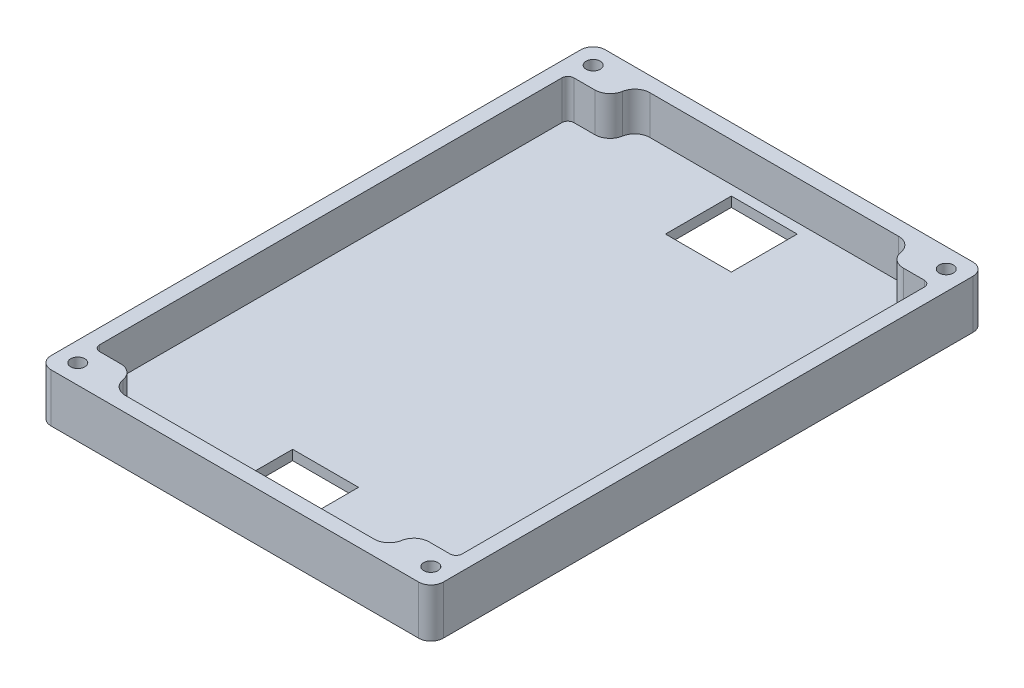
from build123d import *

# Parameters (mm, degrees)
BOSS_EXTRUDE1_DEPTH                                 = 15.0114
CUT_EXTRUDE1_DEPTH                                  = 11.9634
MIRROR2_COPY_1_DEPTH                                = 11.9634
CBORE_SLOT_FOR_3_BINDING_HEAD_MACHINE_S_D           = 4.3688
CBORE_SLOT_FOR_3_BINDING_HEAD_MACHINE_S_CBORE_D     = 7.874
CBORE_SLOT_FOR_3_BINDING_HEAD_MACHINE_S_CBORE_DEPTH = 3.048
MIRROR4_COPY_1_D                                    = 4.3688
MIRROR4_COPY_1_CBORE_D                              = 7.874
MIRROR4_COPY_1_CBORE_DEPTH                          = 3.048
SKETCH10_W                                          = 20.32
SKETCH10_H                                          = 20.32
CUT_EXTRUDE3_DEPTH                                  = 3.048


with BuildPart() as part:
    # Sketch2 → Boss-Extrude1 (new body)
    with BuildSketch(Plane(origin=(0, 0, 0), x_dir=(1, 0, 0), z_dir=(0, 1, 0))):
        with BuildLine():
            Line((56.6928, -85.4964), (-56.6928, -85.4964))
            ThreePointArc((-56.6928, -85.4964), (-59.386876836, -84.380476836), (-60.5028, -81.6864))
            Line((-60.5028, -81.6864), (-60.5028, 81.6864))
            ThreePointArc((-60.5028, 81.6864), (-59.386876836, 84.380476836), (-56.6928, 85.4964))
            Line((-56.6928, 85.4964), (56.6928, 85.4964))
            ThreePointArc((56.6928, 85.4964), (59.386876836, 84.380476836), (60.5028, 81.6864))
            Line((60.5028, 81.6864), (60.5028, -81.6864))
            ThreePointArc((60.5028, -81.6864), (59.386876836, -84.380476836), (56.6928, -85.4964))
        make_face()
    extrude(amount=BOSS_EXTRUDE1_DEPTH)

    # Sketch3 → Cut-Extrude1 (cut)
    with BuildSketch(Plane(origin=(0, 15.0114, 0), x_dir=(1, 0, 0), z_dir=(0, 1, 0))):
        with BuildLine():
            Line((-55.9054, 0), (-55.9054, 71.294481899))
            ThreePointArc((-55.9054, 71.294481899), (-55.361345544, 72.607945544), (-54.047881899, 73.152))
            Line((-54.047881899, 73.152), (-47.553880656, 73.152))
            ThreePointArc((-47.553880656, 73.152), (-44.550315934, 74.249721203), (-42.962410096, 77.0255))
            ThreePointArc((-42.962410096, 77.0255), (-41.374504259, 79.801278797), (-38.370939537, 80.899))
            Line((-38.370939537, 80.899), (0, 80.899))
            Line((0, 80.899), (0, 0))
            Line((0, 0), (-55.9054, 0))
        make_face()
    cut_extrude1 = extrude(amount=-CUT_EXTRUDE1_DEPTH, mode=Mode.SUBTRACT)

    # Mirror1: Cut-Extrude1 across plane
    add(cut_extrude1.mirror(Plane(origin=(0, 0, 0), x_dir=(0, 0, 1), z_dir=(1, 0, 0))), mode=Mode.SUBTRACT)

    # Mirror2: Cut-Extrude1 across plane
    add(cut_extrude1.mirror(Plane.XY), mode=Mode.SUBTRACT)

    # Mirror2 copy 1 sketch → Mirror2 copy 1 (cut)
    with BuildSketch(Plane(origin=(0, 15.0114, 0), x_dir=(-1, 0, 0), z_dir=(0, 1, 0))):
        with BuildLine():
            Line((-55.9054, 0), (-55.9054, 71.294481899))
            ThreePointArc((-55.9054, 71.294481899), (-55.361345544, 72.607945544), (-54.047881899, 73.152))
            Line((-54.047881899, 73.152), (-47.553880656, 73.152))
            ThreePointArc((-47.553880656, 73.152), (-44.550315934, 74.249721203), (-42.962410096, 77.0255))
            ThreePointArc((-42.962410096, 77.0255), (-41.374504259, 79.801278797), (-38.370939537, 80.899))
            Line((-38.370939537, 80.899), (0, 80.899))
            Line((0, 80.899), (0, 0))
            Line((0, 0), (-55.9054, 0))
        make_face()
    extrude(amount=-MIRROR2_COPY_1_DEPTH, mode=Mode.SUBTRACT)

    # CBORE SLOT for #3 Binding Head Machine Screw1 (through all)
    with Locations(Plane(origin=(0, 0, 0), x_dir=(-1, 0, 0), z_dir=(0, -1, 0))):
        with Locations((-54.4576, 79.502)):
            cbore_slot_for_3_binding_head_machine_s = CounterBoreHole(CBORE_SLOT_FOR_3_BINDING_HEAD_MACHINE_S_D / 2, CBORE_SLOT_FOR_3_BINDING_HEAD_MACHINE_S_CBORE_D / 2, CBORE_SLOT_FOR_3_BINDING_HEAD_MACHINE_S_CBORE_DEPTH)

    # Mirror3: CBORE SLOT for #3 Binding Head Machine Screw1 across plane
    add(cbore_slot_for_3_binding_head_machine_s.mirror(Plane(origin=(0, 0, 0), x_dir=(0, 0, 1), z_dir=(1, 0, 0))), mode=Mode.SUBTRACT)

    # Mirror4: CBORE SLOT for #3 Binding Head Machine Screw1 across plane
    add(cbore_slot_for_3_binding_head_machine_s.mirror(Plane.XY), mode=Mode.SUBTRACT)

    # Mirror4 copy 1 (through all)
    with Locations(Plane.XZ):
        with Locations((-54.4576, 79.502)):
            CounterBoreHole(MIRROR4_COPY_1_D / 2, MIRROR4_COPY_1_CBORE_D / 2, MIRROR4_COPY_1_CBORE_DEPTH)

    # Sketch10 → Cut-Extrude3 (cut)
    with BuildSketch(Plane.XZ):
        with Locations((0, 67.66)):
            Rectangle(SKETCH10_W, SKETCH10_H)
    cut_extrude3 = extrude(amount=-CUT_EXTRUDE3_DEPTH, mode=Mode.SUBTRACT)

    # Mirror7: Cut-Extrude3 across plane
    add(cut_extrude3.mirror(Plane.XY), mode=Mode.SUBTRACT)


solid = part.part
